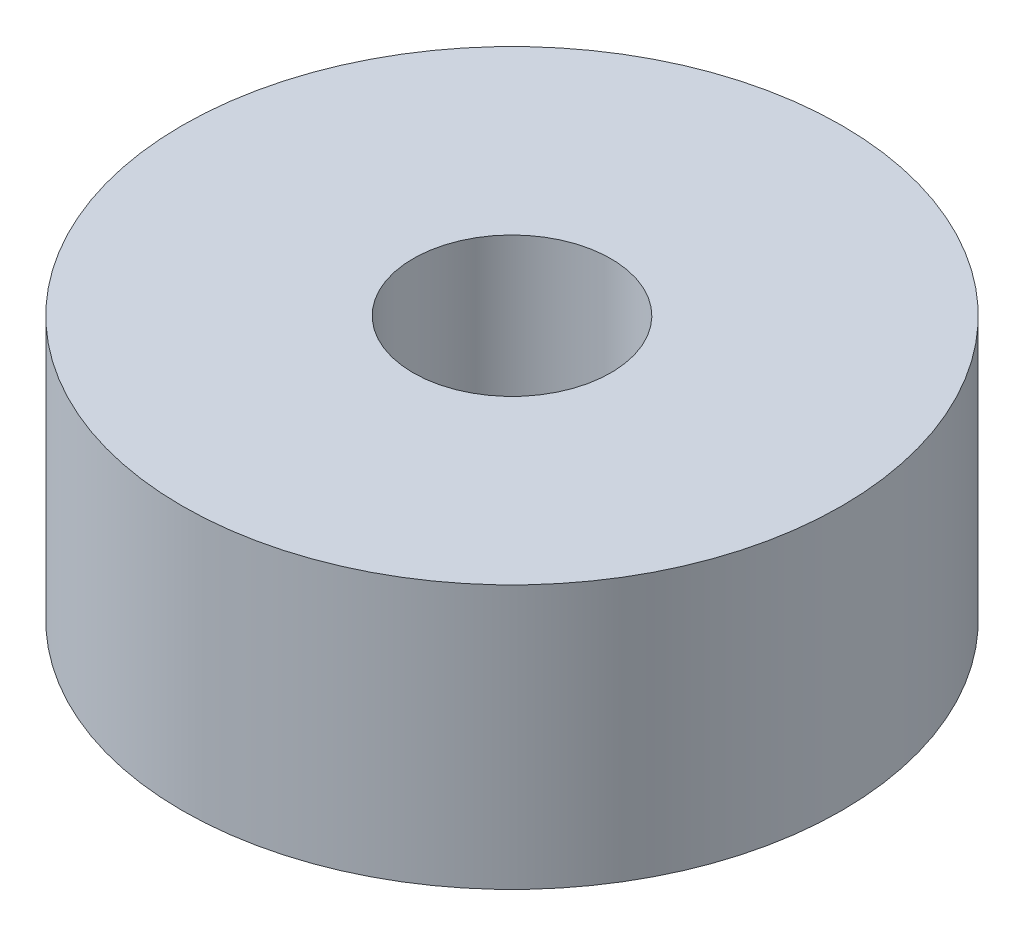
from build123d import *

# Parameters (mm, degrees)
SKETCH1_R           = 63.5
SKETCH1_R_2         = 19.05
BOSS_EXTRUDE1_DEPTH = 25.4


with BuildPart() as part:
    # Sketch1 → Boss-Extrude1 (new, symmetric)
    with BuildSketch(Plane(origin=(0, 0, 0), x_dir=(1, 0, 0), z_dir=(0, 1, 0))):
        with Locations(Location((0, 0, 0), (0, 0, 270))):
            Circle(SKETCH1_R)
        with Locations(Location((0, 0, 0), (0, 0, 270))):
            Circle(SKETCH1_R_2, mode=Mode.SUBTRACT)
    extrude(amount=BOSS_EXTRUDE1_DEPTH, both=True)


solid = part.part
